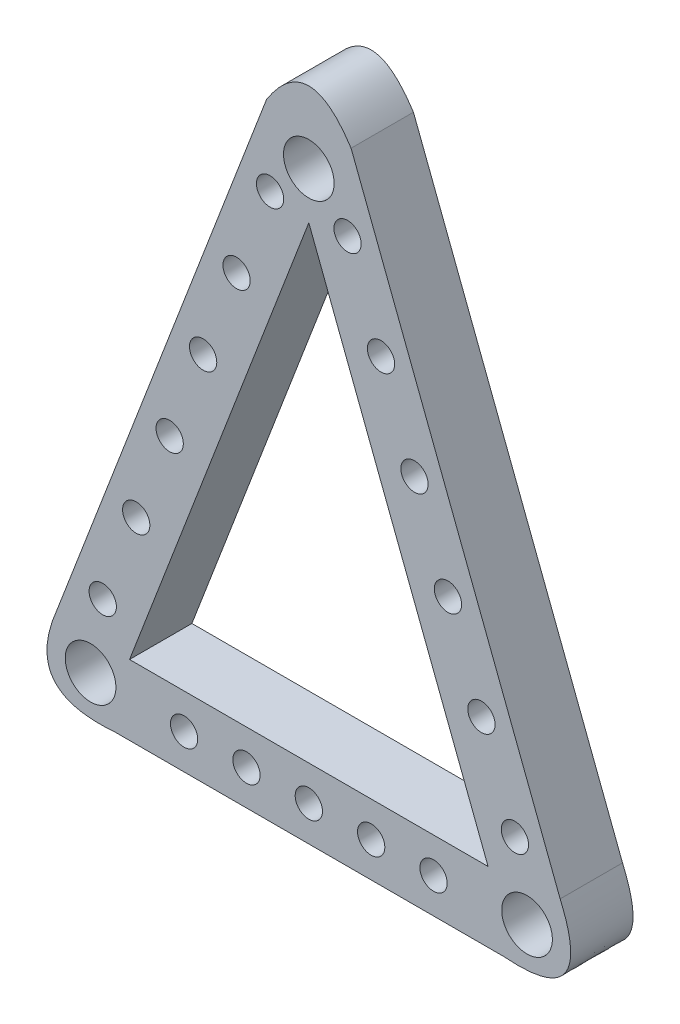
from build123d import *

# Parameters (mm, degrees)
SKETCH_1_R      = 3.25
SKETCH_1_R_2    = 1.75
EXTRUDE_1_DEPTH = 8


with BuildPart() as part:
    # 草圖1 → 填料-伸長1 (new body)
    with BuildSketch(Plane.XY):
        with BuildLine():
            Line((-5.423089748, 35), (-32.24596582, -35))
            add(Edge.make_bspline(
                [(-32.24596582, -35), (-37, -46), (-25, -45.023391813)],
                knots=[0, 0, 0, 1, 1, 1], degree=2))
            Line((-25, -45.023391813), (25, -45.023391813))
            add(Edge.make_bspline(
                [(32.24596582, -35), (37, -46), (25, -45.023391813)],
                knots=[0, 0, 0, 1, 1, 1], degree=2))
            Line((32.24596582, -35), (5.423089748, 35))
            add(Edge.make_bspline(
                [(-5.423089748, 35), (0, 43.412192281), (5.423089748, 35)],
                knots=[0, 0, 0, 1, 1, 1], degree=2))
        make_face()
        with Locations((0, 30)):
            Circle(SKETCH_1_R, mode=Mode.SUBTRACT)
        with Locations((-28, -40)):
            Circle(SKETCH_1_R, mode=Mode.SUBTRACT)
        with Locations((28, -40)):
            Circle(SKETCH_1_R, mode=Mode.SUBTRACT)
        with Locations((-4.971323351, 25)):
            Circle(SKETCH_1_R_2, mode=Mode.SUBTRACT)
        with Locations((-9.265095937, 13.794487206)):
            Circle(SKETCH_1_R_2, mode=Mode.SUBTRACT)
        with Locations((-13.558868522, 2.588974411)):
            Circle(SKETCH_1_R_2, mode=Mode.SUBTRACT)
        with Locations((-17.852641108, -8.616538383)):
            Circle(SKETCH_1_R_2, mode=Mode.SUBTRACT)
        with Locations((-22.146413694, -19.822051177)):
            Circle(SKETCH_1_R_2, mode=Mode.SUBTRACT)
        with Locations((-26.44018628, -31.027563971)):
            Circle(SKETCH_1_R_2, mode=Mode.SUBTRACT)
        with Locations((-16, -40.523391813)):
            Circle(SKETCH_1_R_2, mode=Mode.SUBTRACT)
        with Locations((-8, -40.523391813)):
            Circle(SKETCH_1_R_2, mode=Mode.SUBTRACT)
        with Locations((0, -40.523391813)):
            Circle(SKETCH_1_R_2, mode=Mode.SUBTRACT)
        with Locations(Location((8, -40.523391813, 0), (0, 0, 180))):
            Circle(SKETCH_1_R_2, mode=Mode.SUBTRACT)
        with Locations(Location((16, -40.523391813, 0), (0, 0, 180))):
            Circle(SKETCH_1_R_2, mode=Mode.SUBTRACT)
        with Locations(Location((26.44018628, -31.027563971, 0), (0, 0, 180))):
            Circle(SKETCH_1_R_2, mode=Mode.SUBTRACT)
        with Locations(Location((22.146413694, -19.822051177, 0), (0, 0, 180))):
            Circle(SKETCH_1_R_2, mode=Mode.SUBTRACT)
        with Locations(Location((17.852641108, -8.616538383, 0), (0, 0, 180))):
            Circle(SKETCH_1_R_2, mode=Mode.SUBTRACT)
        with Locations(Location((13.558868522, 2.588974411, 0), (0, 0, 180))):
            Circle(SKETCH_1_R_2, mode=Mode.SUBTRACT)
        with Locations(Location((9.265095937, 13.794487206, 0), (0, 0, 180))):
            Circle(SKETCH_1_R_2, mode=Mode.SUBTRACT)
        with Locations(Location((4.971323351, 25, 0), (0, 0, 180))):
            Circle(SKETCH_1_R_2, mode=Mode.SUBTRACT)
        Polygon((0, 24), (-23, -36.023391813), (23, -36.023391813), align=None, mode=Mode.SUBTRACT)
    extrude(amount=EXTRUDE_1_DEPTH)


solid = part.part
